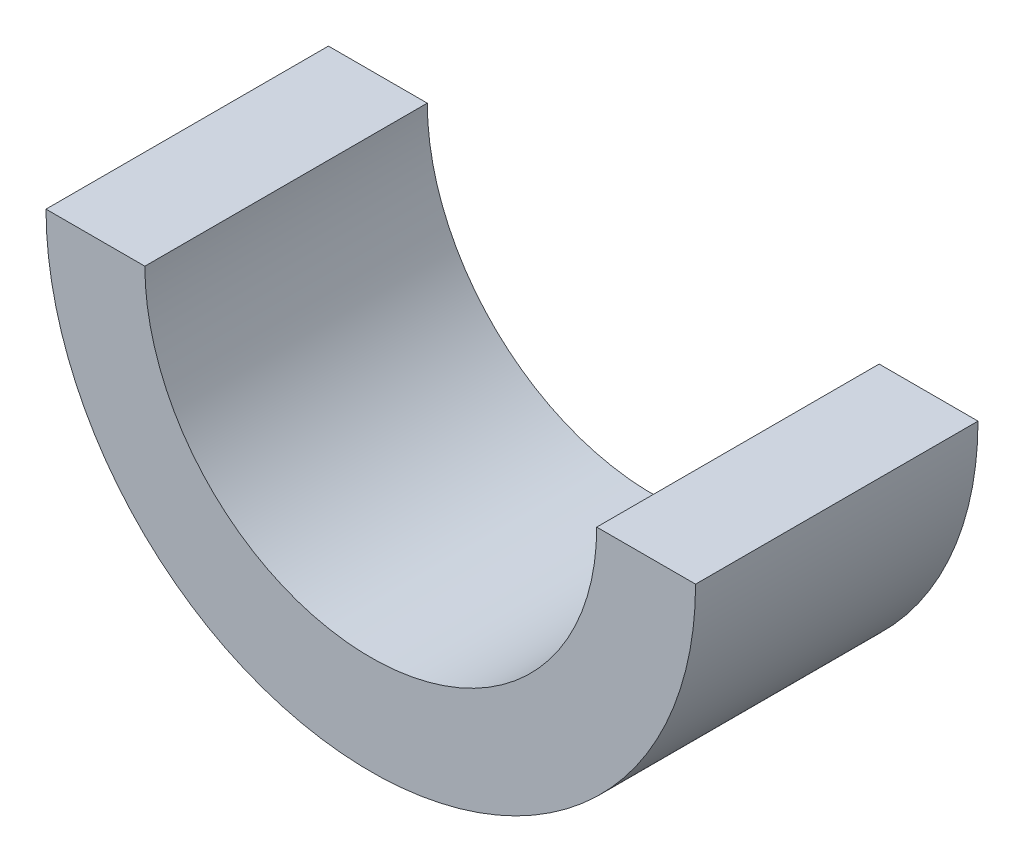
from build123d import *

# Parameters (mm, degrees)
PROFILE_DEPTH = 20


with BuildPart() as part:
    # Sketch1 → Profile (new body)
    with BuildSketch(Plane.XY):
        with BuildLine():
            Line((46, 23), (39, 23))
            ThreePointArc((39, 23), (23, 7), (7, 23))
            Line((7, 23), (0, 23))
            ThreePointArc((0, 23), (23, 0), (46, 23))
        make_face()
    extrude(amount=PROFILE_DEPTH)


solid = part.part
